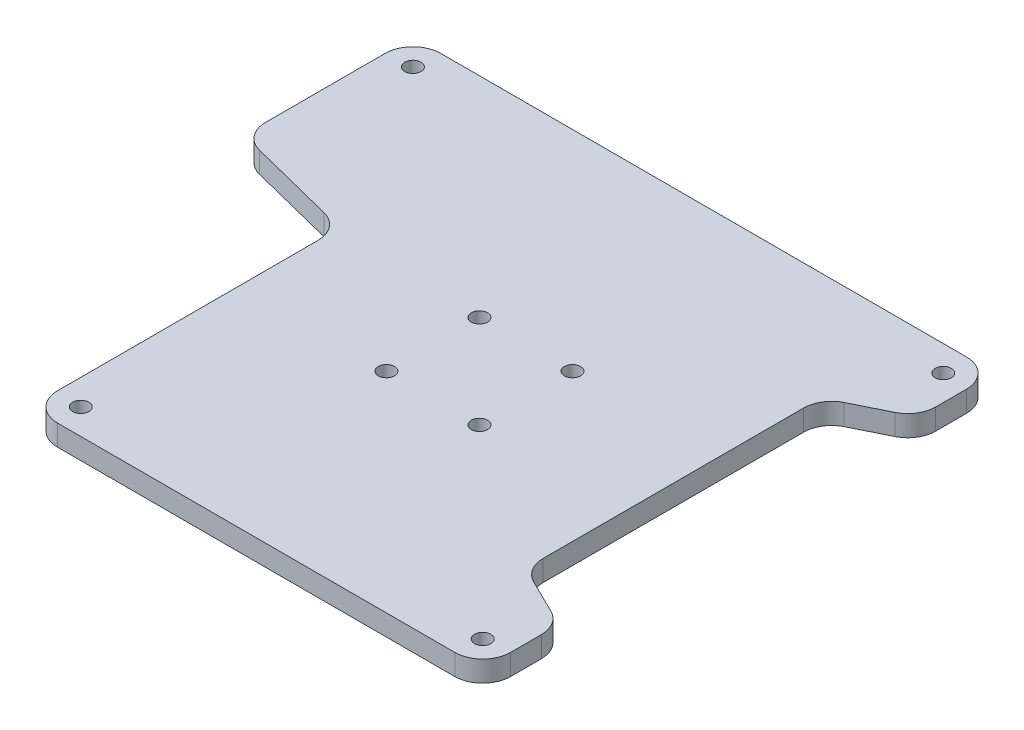
from build123d import *

# Parameters (mm, degrees)
SKETCH1_R           = 1.75
BOSS_EXTRUDE1_DEPTH = 4.5


with BuildPart() as part:
    # Sketch1 → Boss-Extrude1 (new body)
    with BuildSketch(Plane(origin=(0, 0, 0), x_dir=(1, 0, 0), z_dir=(0, 1, 0))):
        with BuildLine():
            Line((-35.7, -55), (49.7, -55))
            ThreePointArc((49.7, -55), (53.942640687, -53.242640687), (55.7, -49))
            Line((55.7, -49), (55.7, -42.377818725))
            ThreePointArc((55.7, -42.377818725), (54.797249664, -39.212689049), (52.36065138, -37))
            Line((52.36065138, -37), (45.03934862, -33.377818725))
            ThreePointArc((45.03934862, -33.377818725), (42.602750336, -31.165129675), (41.7, -28))
            Line((41.7, -28), (41.7, 28))
            ThreePointArc((41.7, 28), (42.602750336, 31.165129675), (45.03934862, 33.377818725))
            Line((45.03934862, 33.377818725), (52.36065138, 37))
            ThreePointArc((52.36065138, 37), (54.797249664, 39.212689049), (55.7, 42.377818725))
            Line((55.7, 42.377818725), (55.7, 49))
            ThreePointArc((55.7, 49), (53.942640687, 53.242640687), (49.7, 55))
            Line((49.7, 55), (-63.3, 55))
            ThreePointArc((-63.3, 55), (-67.542640687, 53.242640687), (-69.3, 49))
            Line((-69.3, 49), (-69.3, 23.31729281))
            ThreePointArc((-69.3, 23.31729281), (-68.03372658, 19.630582533), (-64.769389112, 17.5))
            Line((-64.769389112, 17.5), (-46.230610888, 12.81729281))
            ThreePointArc((-46.230610888, 12.81729281), (-42.96627342, 10.686710277), (-41.7, 7))
            Line((-41.7, 7), (-41.7, -49))
            ThreePointArc((-41.7, -49), (-39.942640687, -53.242640687), (-35.7, -55))
        make_face()
        with Locations(Location((-63.8, 49.5, 0), (0, 0, 270))):
            Circle(SKETCH1_R, mode=Mode.SUBTRACT)
        with Locations(Location((-36.2, -49.5, 0), (0, 0, 270))):
            Circle(SKETCH1_R, mode=Mode.SUBTRACT)
        with Locations(Location((50.2, -49.5, 0), (0, 0, 270))):
            Circle(SKETCH1_R, mode=Mode.SUBTRACT)
        with Locations(Location((50.2, 49.5, 0), (0, 0, 270))):
            Circle(SKETCH1_R, mode=Mode.SUBTRACT)
        with Locations(Location((-10, 10, 0), (0, 0, 270))):
            Circle(SKETCH1_R, mode=Mode.SUBTRACT)
        with Locations(Location((-10, -10, 0), (0, 0, 270))):
            Circle(SKETCH1_R, mode=Mode.SUBTRACT)
        with Locations(Location((10, -10, 0), (0, 0, 270))):
            Circle(SKETCH1_R, mode=Mode.SUBTRACT)
        with Locations(Location((10, 10, 0), (0, 0, 270))):
            Circle(SKETCH1_R, mode=Mode.SUBTRACT)
    extrude(amount=BOSS_EXTRUDE1_DEPTH)


solid = part.part
